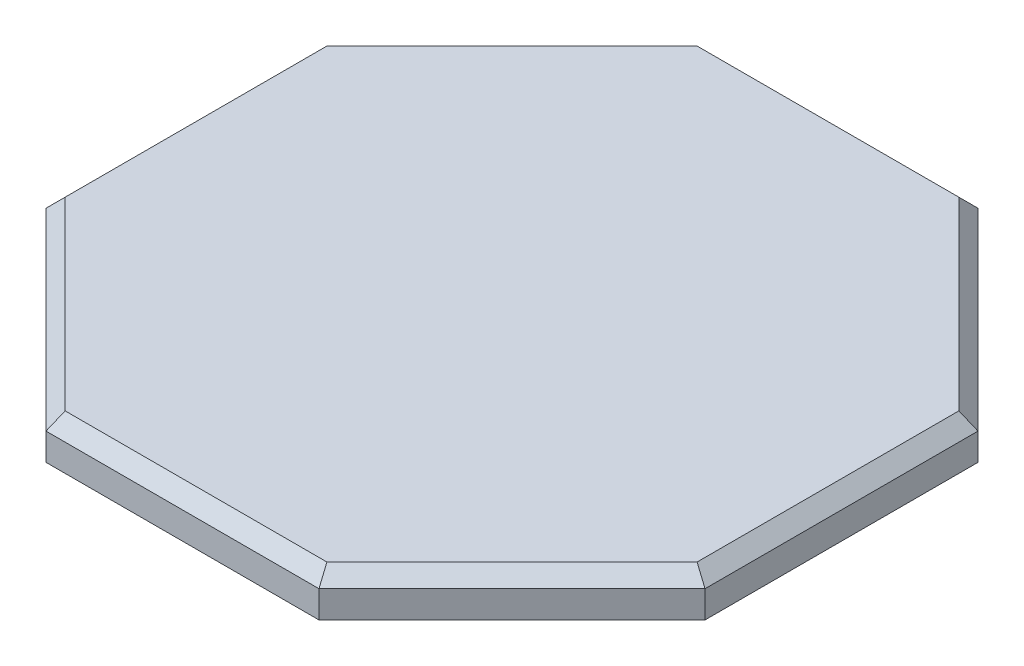
from build123d import *

# Parameters (mm, degrees)
RESSALTO_EXTRUS_O2_DEPTH = 9
CASCA1_T                 = -3
CHANFRO1_SIZE            = 3


with BuildPart() as part:
    # Esboço1 → Ressalto-extrusão2 (new body)
    with BuildSketch(Plane(origin=(0, 0, 0), x_dir=(1, 0, 0), z_dir=(0, 1, 0))):
        Polygon((30.237590053, -73), (73, -30.237590053), (73, 30.237590053), (30.237590053, 73), (-30.237590053, 73), (-73, 30.237590053), (-73, -30.237590053), (-30.237590053, -73), align=None)
    extrude(amount=RESSALTO_EXTRUS_O2_DEPTH)

    # Casca1
    casca1_openings = [part.faces().sort_by_distance(p)[0] for p in [
        (0, 0, 0),
    ]]
    offset(amount=CASCA1_T, openings=casca1_openings, kind=Kind.INTERSECTION)

    # Chanfro1
    chanfro1_edges = [part.edges().sort_by_distance(p)[0] for p in [
        (73, 9, 0),
        (51.618795027, 9, -51.618795027),
        (0, 9, -73),
        (-51.618795027, 9, -51.618795027),
        (-73, 9, 0),
        (-51.618795027, 9, 51.618795027),
        (0, 9, 73),
        (51.618795027, 9, 51.618795027),
    ]]
    chamfer(chanfro1_edges, length=CHANFRO1_SIZE)


solid = part.part
